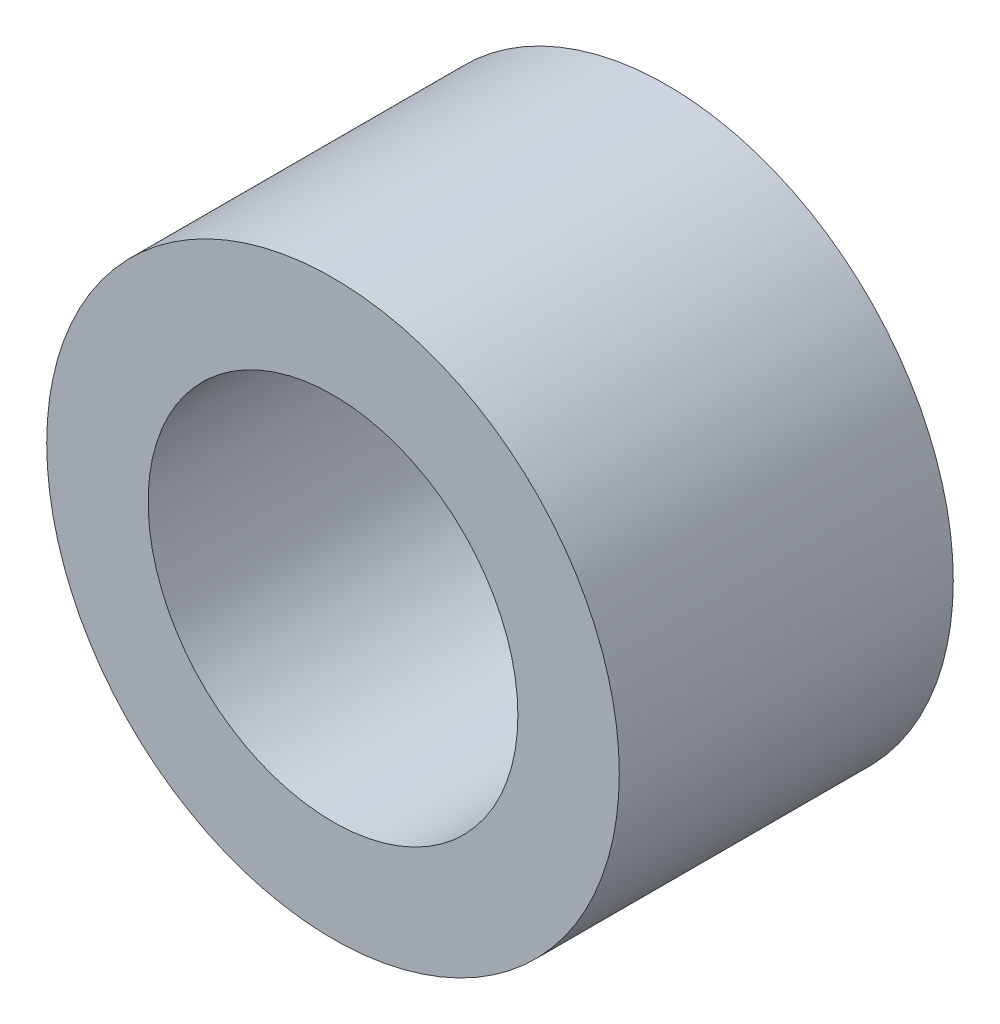
from build123d import *

# Parameters (mm, degrees)
SKETCH1_R           = 24
SKETCH1_R_2         = 15.5
BOSS_EXTRUDE1_DEPTH = 28


with BuildPart() as part:
    # Sketch1 → Boss-Extrude1 (new body)
    with BuildSketch(Plane.XY):
        Circle(SKETCH1_R)
        Circle(SKETCH1_R_2, mode=Mode.SUBTRACT)
    extrude(amount=BOSS_EXTRUDE1_DEPTH)


solid = part.part
